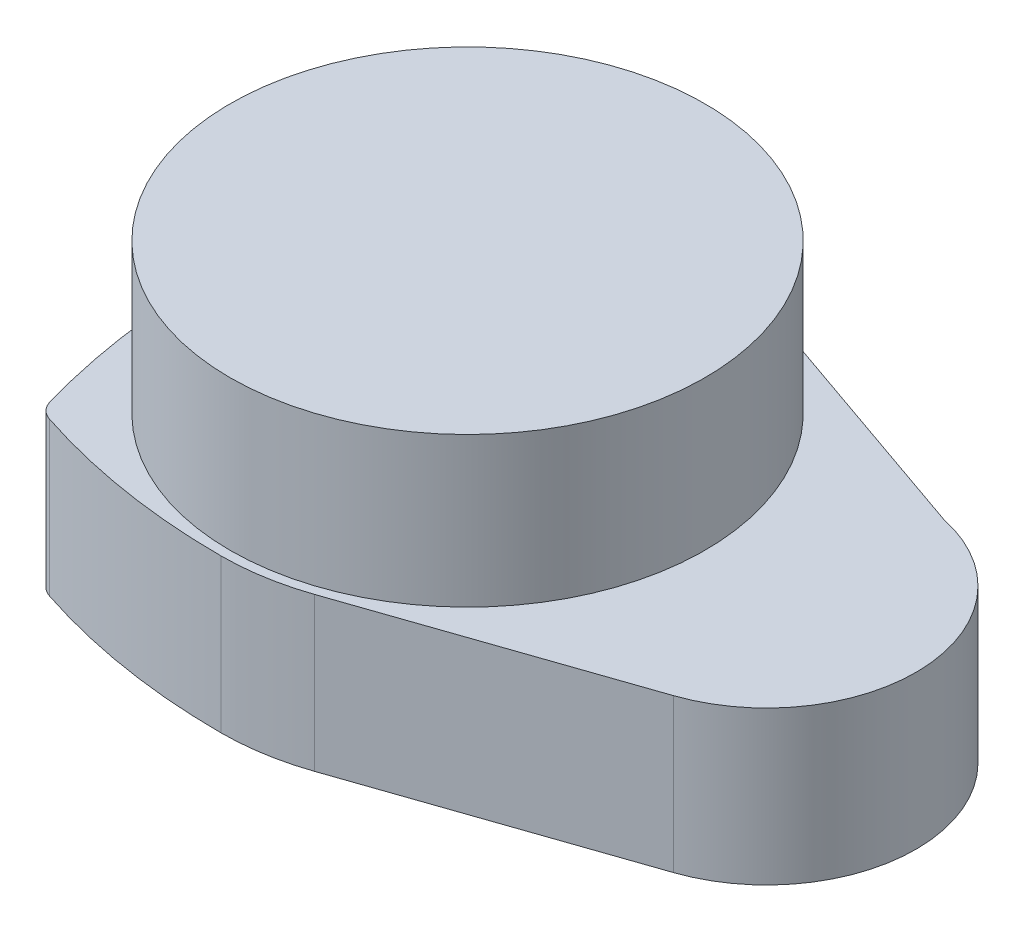
from build123d import *

# Parameters (mm, degrees)
SKETCH_1_R      = 31.75
EXTRUDE_2_DEPTH = 20
EXTRUDE_5_DEPTH = 20.5
FILLET_1_R      = 3


with BuildPart() as part:
    # 草图1 → 凸台-拉伸2 (new body)
    with BuildSketch(Plane(origin=(0, 0, 0), x_dir=(1, 0, 0), z_dir=(0, 1, 0))):
        with Locations(Location((0, 0, 0), (0, 0, 270))):
            Circle(SKETCH_1_R)
    extrude(amount=EXTRUDE_2_DEPTH)

    # 草图3 → 凸台-拉伸5 (add)
    with BuildSketch(Plane.XZ):
        with BuildLine():
            Line((46.5, 18.914280319), (10.725, 31.208562527))
            ThreePointArc((10.725, 31.208562527), (5.436793017, 32.549059613), (0, 33))
            ThreePointArc((0, 33), (-14.61315827, 31.767511075), (-28.813455811, 28.1048654))
            ThreePointArc((-28.813455811, 28.1048654), (-33, 0), (-28.813455811, -28.1048654))
            ThreePointArc((-28.813455811, -28.1048654), (-14.61315827, -31.767511075), (0, -33))
            ThreePointArc((0, -33), (6.028677808, -32.444645843), (11.854443416, -30.797275387))
            Line((11.854443416, -30.797275387), (44.146384059, -19.565467008))
            ThreePointArc((44.146384059, -19.565467008), (59.962693004, -1.221019257), (46.5, 18.914280319))
        make_face()
    extrude(amount=EXTRUDE_5_DEPTH)

    # 圆角1
    fillet_1_edges = [part.edges().sort_by_distance(p)[0] for p in [
        (-28.813455811, -10.25, 28.1048654),
        (-28.813455811, -10.25, -28.1048654),
    ]]
    fillet(fillet_1_edges, radius=FILLET_1_R)


solid = part.part
